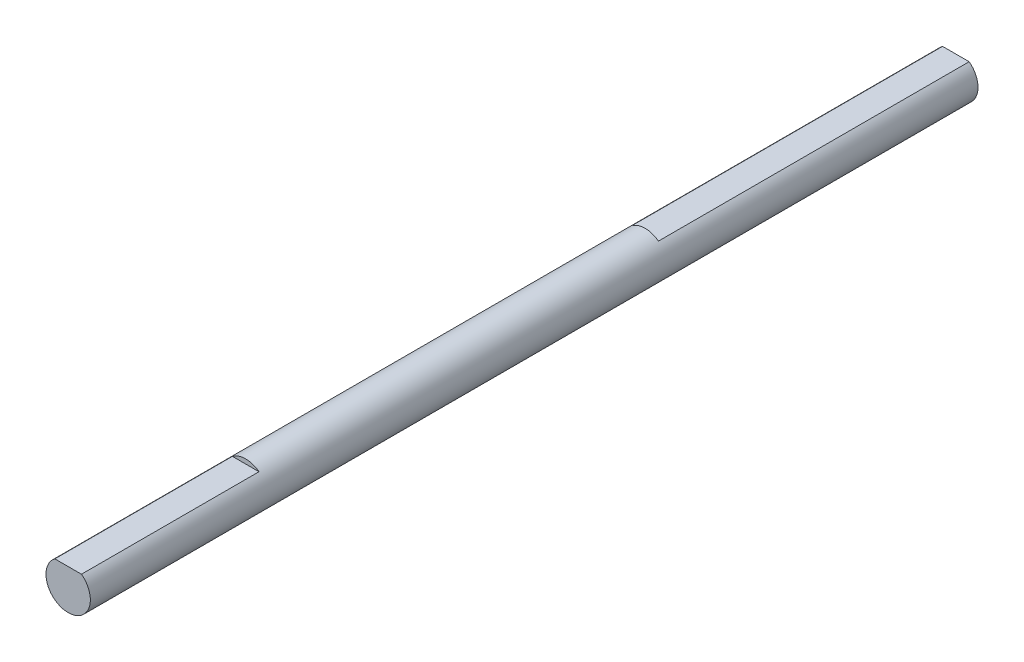
from build123d import *

# Parameters (mm, degrees)
SKETCH1_R           = 5
SKETCH1_R_2         = 2.5
BOSS_EXTRUDE1_DEPTH = 200
SKETCH2_W           = 20
SKETCH2_H           = 2
CUT_EXTRUDE1_DEPTH  = 40
CUT_EXTRUDE2_START  = -70
SKETCH4_W           = 20
SKETCH4_H           = 2
CUT_EXTRUDE2_DEPTH  = 271.124960962


with BuildPart() as part:
    # Sketch1 → Boss-Extrude1 (new body)
    # profile 1 of 2: a face of its own
    with BuildSketch(Plane.XY):
        Circle(SKETCH1_R)
        Circle(SKETCH1_R_2, mode=Mode.SUBTRACT)
    # profile 2 of 2: a face of its own
    with BuildSketch(Plane.XY):
        Circle(SKETCH1_R_2)
    extrude(amount=-BOSS_EXTRUDE1_DEPTH)

    # Sketch2 → Cut-Extrude1 (cut)
    with BuildSketch(Plane.XY):
        with Locations((0, 5)):
            Rectangle(SKETCH2_W, SKETCH2_H)
    extrude(amount=-CUT_EXTRUDE1_DEPTH, mode=Mode.SUBTRACT)

    # Sketch4 → Cut-Extrude2 (cut, through all)
    with BuildSketch(Plane(origin=(0, 0, -200), x_dir=(-1, 0, 0), z_dir=(0, 0, -1)).offset(CUT_EXTRUDE2_START)):
        with Locations((0, 5)):
            Rectangle(SKETCH4_W, SKETCH4_H)
    extrude(amount=CUT_EXTRUDE2_DEPTH, mode=Mode.SUBTRACT)


solid = part.part
